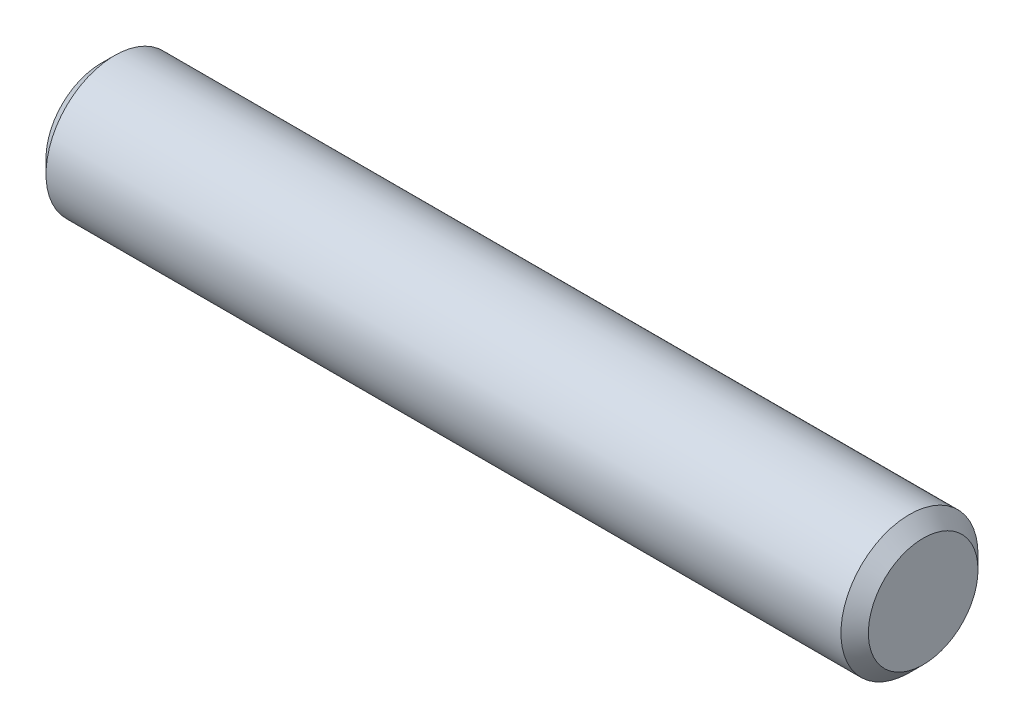
from build123d import *

# Parameters (mm, degrees)
EXTRUDE1_DEPTH      = 9.525
EXTRUDE1_DEPTH_BACK = 9.525
SKETCH2_R           = 1.5875
CHAMFER1_SIZE       = 0.3175


with BuildPart() as part:
    # Sketch2 → Extrude1 (new, two sides: drawn at the far end of the back side and taken through both)
    with BuildSketch(Plane(origin=(0, 0, 0), x_dir=(0, 0, -1), z_dir=(1, 0, 0)).offset(-EXTRUDE1_DEPTH_BACK)):
        Circle(SKETCH2_R)
    extrude(amount=EXTRUDE1_DEPTH + EXTRUDE1_DEPTH_BACK)

    # Chamfer1
    chamfer1_edges = [part.edges().sort_by_distance(p)[0] for p in [
        (-9.525, 0, 1.5875),
        (9.525, 0, 1.5875),
    ]]
    chamfer(chamfer1_edges, length=CHAMFER1_SIZE)


solid = part.part
